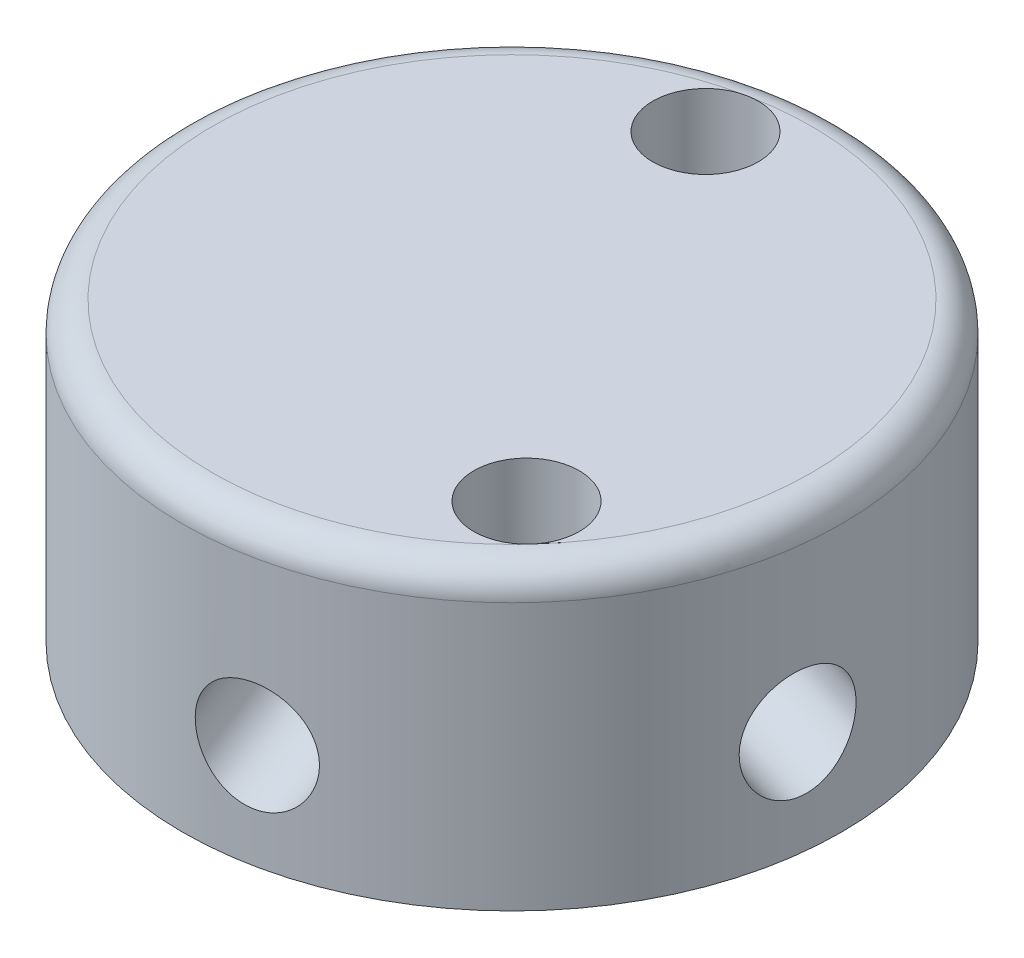
from build123d import *

# Parameters (mm, degrees)
BOSS_EXTRUDE1_DEPTH      = 3
BOSS_EXTRUDE1_DEPTH_BACK = 6
SKETCH1_R                = 10
SKETCH4_R                = 1.6
HOLE_DEPTH               = 19.539009706
HOLECIR_COUNT            = 5
FILLET3_R                = 0.9
SKETCH5_R                = 3.5
CUT_EXTRUDE1_DEPTH       = 2.6
SKETCH6_R                = 1.6
CUT_EXTRUDE2_DEPTH       = 17.763054787


with BuildPart() as part:
    # Sketch1 → Boss-Extrude1 (new, two sides: drawn at the far end of the back side and taken through both)
    with BuildSketch(Plane(origin=(0, 0, 0), x_dir=(1, 0, 0), z_dir=(0, 1, 0)).offset(-BOSS_EXTRUDE1_DEPTH_BACK)):
        Circle(SKETCH1_R)
    extrude(amount=BOSS_EXTRUDE1_DEPTH + BOSS_EXTRUDE1_DEPTH_BACK)

    # Sketch4 → hole (cut, through all)
    with BuildSketch(Plane(origin=(-3.352872105, -1.093066116, 1.887711608), x_dir=(-0.4486862613641547, -0.14627571033740308, -0.8816371449912632), z_dir=(0.8382180262940947, 0.2732665289126682, -0.47192790187872385))):
        Circle(SKETCH4_R)
    hole = extrude(amount=-HOLE_DEPTH, mode=Mode.SUBTRACT)

    # holecir: hole ×5 about axis
    holecir_axis = Axis((0, 5.5, 0), (0, -1, 0))
    for i in range(1, HOLECIR_COUNT):
        add(hole.rotate(holecir_axis, i * 360 / HOLECIR_COUNT), mode=Mode.SUBTRACT)

    # Fillet3
    fillet3_edges = [part.edges().sort_by_distance(p)[0] for p in [
        (-10, 3, 0),
    ]]
    fillet(fillet3_edges, radius=FILLET3_R)

    # Sketch5 → Cut-Extrude1 (cut)
    with BuildSketch(Plane.XZ.offset(6)):
        Circle(SKETCH5_R)
    extrude(amount=-CUT_EXTRUDE1_DEPTH, mode=Mode.SUBTRACT)

    # Sketch6 → Cut-Extrude2 (cut, through all)
    with BuildSketch(Plane(origin=(0, 3, 0), x_dir=(1, 0, 0), z_dir=(0, 1, 0))):
        with Locations((-1.479875163, 7.352548504)):
            Circle(SKETCH6_R)
        with Locations((5.518963734, -5.078487896)):
            Circle(SKETCH6_R)
    extrude(amount=-CUT_EXTRUDE2_DEPTH, mode=Mode.SUBTRACT)


solid = part.part
